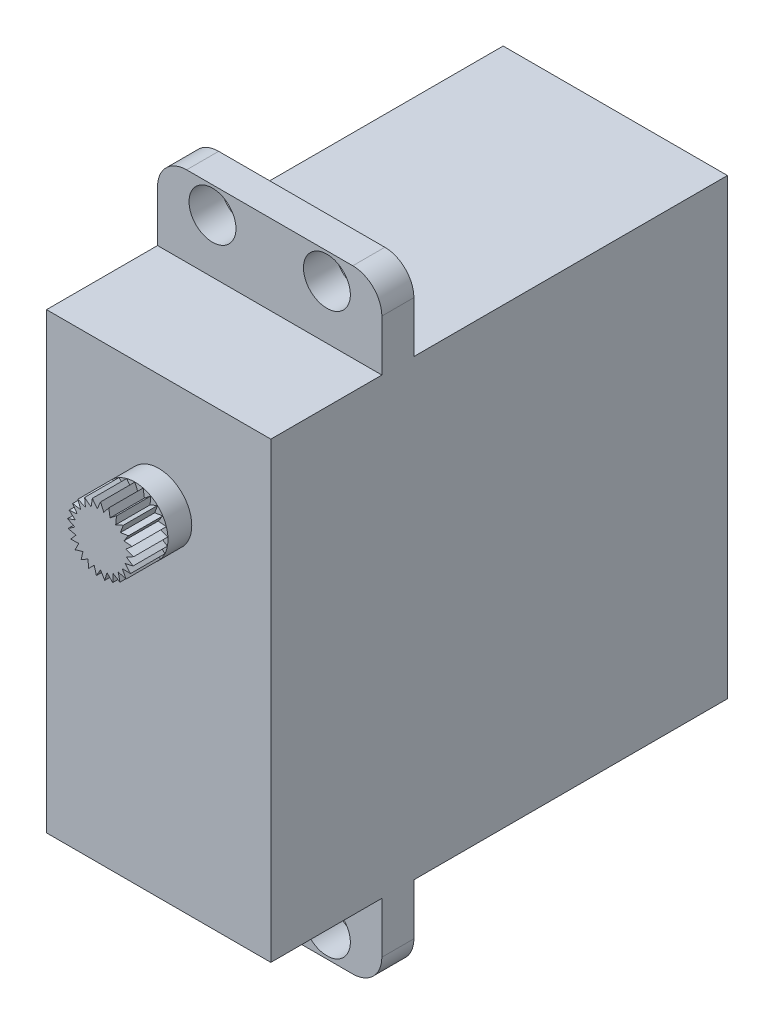
from build123d import *

# Parameters (mm, degrees)
SKETCH1_W           = 19.6
SKETCH1_H           = 39.6
BOSS_EXTRUDE1_DEPTH = 39.9
SKETCH2_R           = 2.89
BOSS_EXTRUDE2_DEPTH = 5.08
SKETCH3_W           = 19.6
SKETCH3_H           = 53.6
BOSS_EXTRUDE3_DEPTH = 2.8
SKETCH4_R           = 2.05
CUT_EXTRUDE1_DEPTH  = 59.887689748
FILLET1_R           = 2.54
CUT_EXTRUDE3_START  = -3
CUT_EXTRUDE3_DEPTH  = 3


with BuildPart() as part:
    # Sketch1 → Boss-Extrude1 (new body)
    with BuildSketch(Plane.XY):
        with Locations((9.8, -19.8)):
            Rectangle(SKETCH1_W, SKETCH1_H)
    extrude(amount=BOSS_EXTRUDE1_DEPTH)

    # Sketch2 → Boss-Extrude2 (add)
    with BuildSketch(Plane.XY.offset(39.9)):
        with Locations((9.8, -10)):
            Circle(SKETCH2_R)
    extrude(amount=BOSS_EXTRUDE2_DEPTH)

    # Sketch3 → Boss-Extrude3 (add)
    with BuildSketch(Plane.XY.offset(27.400000064)):
        with Locations((9.8, -19.8)):
            Rectangle(SKETCH3_W, SKETCH3_H)
    extrude(amount=BOSS_EXTRUDE3_DEPTH)

    # Sketch4 → Cut-Extrude1 (cut, through all)
    with BuildSketch(Plane.XY.offset(30.200000064)):
        with Locations((4.8, 4.7)):
            Circle(SKETCH4_R)
        with Locations((14.8, 4.7)):
            Circle(SKETCH4_R)
        with Locations((4.8, -44.3)):
            Circle(SKETCH4_R)
        with Locations((14.8, -44.3)):
            Circle(SKETCH4_R)
    extrude(amount=-CUT_EXTRUDE1_DEPTH, mode=Mode.SUBTRACT)

    # Fillet1
    fillet1_edges = [part.edges().sort_by_distance(p)[0] for p in [
        (19.6, -46.6, 28.800000064),
        (0, 7, 28.800000064),
        (0, -46.6, 28.800000064),
        (19.6, 7, 28.800000064),
    ]]
    fillet(fillet1_edges, radius=FILLET1_R)

    # Sketch5 → Cut-Extrude3 (cut)
    with BuildSketch(Plane.XY.offset(44.98).offset(CUT_EXTRUDE3_START)):
        with BuildLine():
            ThreePointArc((10.518713774, -7.200794664), (10.162213045, -7.132788513), (9.8, -7.11))
            Line((9.8, -7.11), (10.081999776, -7.767741922))
            Line((10.081999776, -7.767741922), (10.518713774, -7.200794664))
        make_face()
        with BuildLine():
            Line((9.518000224, -7.767741922), (9.8, -7.11))
            ThreePointArc((9.8, -7.11), (9.437786955, -7.132788513), (9.081286226, -7.200794664))
            Line((9.081286226, -7.200794664), (9.518000224, -7.767741922))
        make_face()
        with BuildLine():
            Line((8.971719756, -7.908002907), (9.081286226, -7.200794664))
            ThreePointArc((9.081286226, -7.200794664), (8.736120043, -7.312945956), (8.407731882, -7.467473695))
            Line((8.407731882, -7.467473695), (8.971719756, -7.908002907))
        make_face()
        with BuildLine():
            Line((8.477483182, -8.179711763), (8.407731882, -7.467473695))
            ThreePointArc((8.407731882, -7.467473695), (8.101300621, -7.661940886), (7.821658864, -7.893280667))
            Line((7.821658864, -7.893280667), (8.477483182, -8.179711763))
        make_face()
        with BuildLine():
            Line((8.066345204, -8.565796023), (7.821658864, -7.893280667))
            ThreePointArc((7.821658864, -7.893280667), (7.573216728, -8.15784467), (7.359892295, -8.451460563))
            Line((7.359892295, -8.451460563), (8.066345204, -8.565796023))
        make_face()
        with BuildLine():
            Line((7.764139132, -9.041996594), (7.359892295, -8.451460563))
            ThreePointArc((7.359892295, -8.451460563), (7.185049818, -8.769497847), (7.051446668, -9.106940886))
            Line((7.051446668, -9.106940886), (7.764139132, -9.041996594))
        make_face()
        with BuildLine():
            Line((7.589853686, -9.578392042), (7.051446668, -9.106940886))
            ThreePointArc((7.051446668, -9.106940886), (6.961189845, -9.458468001), (6.915702755, -9.818535399))
            Line((6.915702755, -9.818535399), (7.589853686, -9.578392042))
        make_face()
        with BuildLine():
            Line((7.554439861, -10.141278669), (6.915702755, -9.818535399))
            ThreePointArc((6.915702755, -9.818535399), (6.915702755, -10.181464601), (6.961189845, -10.541531999))
            Line((6.961189845, -10.541531999), (7.554439861, -10.141278669))
        make_face()
        with BuildLine():
            Line((7.660122838, -10.695288237), (6.961189845, -10.541531999))
            ThreePointArc((6.961189845, -10.541531999), (7.051446668, -10.893059114), (7.185049818, -11.230502153))
            Line((7.185049818, -11.230502153), (7.660122838, -10.695288237))
        make_face()
        with BuildLine():
            ThreePointArc((11.778341136, -7.893280667), (11.498699379, -7.661940886), (11.192268118, -7.467473695))
            Line((11.192268118, -7.467473695), (11.122516818, -8.179711763))
            Line((11.122516818, -8.179711763), (11.778341136, -7.893280667))
        make_face()
        with BuildLine():
            ThreePointArc((11.192268118, -7.467473695), (10.863879957, -7.312945956), (10.518713774, -7.200794664))
            Line((10.518713774, -7.200794664), (10.628280244, -7.908002907))
            Line((10.628280244, -7.908002907), (11.192268118, -7.467473695))
        make_face()
        with BuildLine():
            ThreePointArc((12.240107705, -8.451460563), (12.026783272, -8.15784467), (11.778341136, -7.893280667))
            Line((11.778341136, -7.893280667), (11.533654796, -8.565796023))
            Line((11.533654796, -8.565796023), (12.240107705, -8.451460563))
        make_face()
        with BuildLine():
            ThreePointArc((12.548553332, -9.106940886), (12.414950182, -8.769497847), (12.240107705, -8.451460563))
            Line((12.240107705, -8.451460563), (11.835860868, -9.041996594))
            Line((11.835860868, -9.041996594), (12.548553332, -9.106940886))
        make_face()
        with BuildLine():
            ThreePointArc((12.684297245, -9.818535399), (12.638810155, -9.458468001), (12.548553332, -9.106940886))
            Line((12.548553332, -9.106940886), (12.010146314, -9.578392042))
            Line((12.010146314, -9.578392042), (12.684297245, -9.818535399))
        make_face()
        with BuildLine():
            ThreePointArc((12.69, -10), (12.688573959, -9.909222906), (12.684297245, -9.818535399))
            Line((12.684297245, -9.818535399), (12.045560139, -10.141278669))
            Line((12.045560139, -10.141278669), (12.638810155, -10.541531999))
            ThreePointArc((12.638810155, -10.541531999), (12.677174078, -10.271973025), (12.69, -10))
        make_face()
        with BuildLine():
            ThreePointArc((12.414950182, -11.230502153), (12.548553332, -10.893059114), (12.638810155, -10.541531999))
            Line((12.638810155, -10.541531999), (11.939877162, -10.695288237))
            Line((11.939877162, -10.695288237), (12.414950182, -11.230502153))
        make_face()
        with BuildLine():
            ThreePointArc((12.026783272, -11.84215533), (12.240107705, -11.548539437), (12.414950182, -11.230502153))
            Line((12.414950182, -11.230502153), (11.699737832, -11.205610289))
            Line((11.699737832, -11.205610289), (12.026783272, -11.84215533))
        make_face()
        with BuildLine():
            ThreePointArc((11.498699379, -12.338059114), (11.778341136, -12.106719333), (12.026783272, -11.84215533))
            Line((12.026783272, -11.84215533), (11.340230988, -11.640179412))
            Line((11.340230988, -11.640179412), (11.498699379, -12.338059114))
        make_face()
        with BuildLine():
            ThreePointArc((10.863879957, -12.687054044), (11.192268118, -12.532526305), (11.498699379, -12.338059114))
            Line((11.498699379, -12.338059114), (10.883945767, -11.97169003))
            Line((10.883945767, -11.97169003), (10.863879957, -12.687054044))
        make_face()
        with BuildLine():
            ThreePointArc((10.162213045, -12.867211487), (10.518713774, -12.799205336), (10.863879957, -12.687054044))
            Line((10.863879957, -12.687054044), (10.359552246, -12.179312113))
            Line((10.359552246, -12.179312113), (10.162213045, -12.867211487))
        make_face()
        with BuildLine():
            Line((9.8, -12.25), (9.437786955, -12.867211487))
            ThreePointArc((9.437786955, -12.867211487), (9.8, -12.89), (10.162213045, -12.867211487))
            Line((10.162213045, -12.867211487), (9.8, -12.25))
        make_face()
        with BuildLine():
            Line((9.240447754, -12.179312113), (8.736120043, -12.687054044))
            ThreePointArc((8.736120043, -12.687054044), (9.081286226, -12.799205336), (9.437786955, -12.867211487))
            Line((9.437786955, -12.867211487), (9.240447754, -12.179312113))
        make_face()
        with BuildLine():
            Line((8.716054233, -11.97169003), (8.101300621, -12.338059114))
            ThreePointArc((8.101300621, -12.338059114), (8.407731882, -12.532526305), (8.736120043, -12.687054044))
            Line((8.736120043, -12.687054044), (8.716054233, -11.97169003))
        make_face()
        with BuildLine():
            Line((8.259769012, -11.640179412), (7.573216728, -11.84215533))
            ThreePointArc((7.573216728, -11.84215533), (7.821658864, -12.106719333), (8.101300621, -12.338059114))
            Line((8.101300621, -12.338059114), (8.259769012, -11.640179412))
        make_face()
        with BuildLine():
            Line((7.900262168, -11.205610289), (7.185049818, -11.230502153))
            ThreePointArc((7.185049818, -11.230502153), (7.359892295, -11.548539437), (7.573216728, -11.84215533))
            Line((7.573216728, -11.84215533), (7.900262168, -11.205610289))
        make_face()
    extrude(amount=CUT_EXTRUDE3_DEPTH, mode=Mode.SUBTRACT)


solid = part.part
